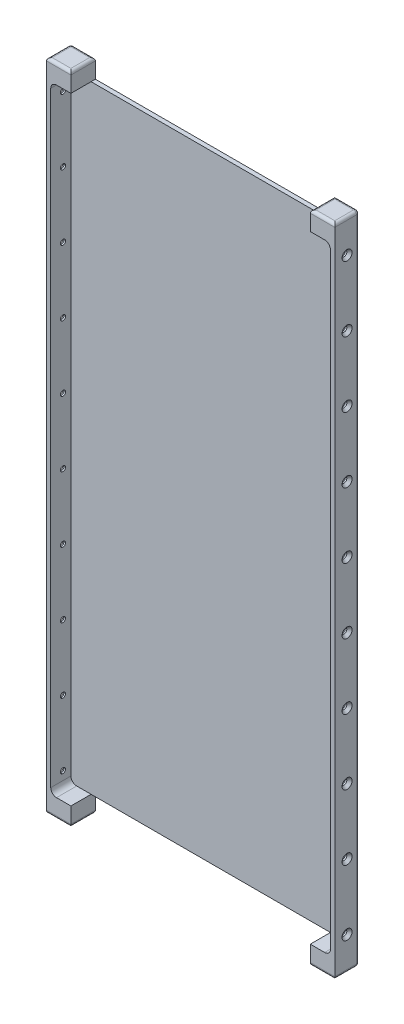
from build123d import *

# Parameters (mm, degrees)
BOSS_EXTRUDE1_DEPTH                           = 8.5
FILLET1_R                                     = 1
SKETCH2_W                                     = 83
SKETCH2_H                                     = 214
CUT_EXTRUDE1_DEPTH                            = 7
SKETCH3_W                                     = 97
SKETCH3_H                                     = 214
CUT_EXTRUDE2_DEPTH                            = 7
FILLET2_R                                     = 2
CSK_FOR_0_FLAT_HEAD_MACHINE_SCREW1_AT_2_COUNT = 2
CSK_FOR_0_FLAT_HEAD_MACHINE_SCREW1_AT_2_PITCH = 22.666666667
CSK_FOR_0_FLAT_HEAD_MACHINE_SCREW1_AT_3_COUNT = 2
CSK_FOR_0_FLAT_HEAD_MACHINE_SCREW1_AT_3_PITCH = 45.333333333
CSK_FOR_0_FLAT_HEAD_MACHINE_SCREW1_AT_4_COUNT = 2
CSK_FOR_0_FLAT_HEAD_MACHINE_SCREW1_AT_4_PITCH = 68
CSK_FOR_0_FLAT_HEAD_MACHINE_SCREW1_AT_5_COUNT = 2
CSK_FOR_0_FLAT_HEAD_MACHINE_SCREW1_AT_5_PITCH = 90.666666667
CSK_FOR_0_FLAT_HEAD_MACHINE_SCREW1_AT_6_COUNT = 2
CSK_FOR_0_FLAT_HEAD_MACHINE_SCREW1_AT_6_PITCH = 113.333333333
CSK_FOR_0_FLAT_HEAD_MACHINE_SCREW1_AT_7_COUNT = 2
CSK_FOR_0_FLAT_HEAD_MACHINE_SCREW1_AT_7_PITCH = 136
CSK_FOR_0_FLAT_HEAD_MACHINE_SCREW1_AT_8_COUNT = 2
CSK_FOR_0_FLAT_HEAD_MACHINE_SCREW1_AT_8_PITCH = 158.666666667
CSK_FOR_0_FLAT_HEAD_MACHINE_SCREW1_AT_9_COUNT = 2
CSK_FOR_0_FLAT_HEAD_MACHINE_SCREW1_AT_9_PITCH = 181.333333333
CSK_FOR_0_FLAT_HEAD_MACHINE_SCREW1_AT_1_COUNT = 2
CSK_FOR_0_FLAT_HEAD_MACHINE_SCREW1_AT_1_PITCH = 204


with BuildPart() as part:
    # Sketch1 → Boss-Extrude1 (new body)
    with BuildSketch(Plane.XY):
        Polygon((-41.5, -107), (41.5, -107), (41.5, -113.5), (50, -113.5), (50, -107), (50, 107), (50, 113.5), (41.5, 113.5), (41.5, 107), (-41.5, 107), (-41.5, 113.5), (-50, 113.5), (-50, 107), (-50, -107), (-50, -113.5), (-41.5, -113.5), align=None)
    extrude(amount=BOSS_EXTRUDE1_DEPTH)

    # Fillet1
    fillet1_edges = [part.edges().sort_by_distance(p)[0] for p in [
        (50, 0, 0),
        (45.75, -113.5, 0),
        (-45.75, -113.5, 0),
        (-50, 0, 0),
        (-45.75, 113.5, 0),
        (-45.75, 113.5, 8.5),
        (45.75, 113.5, 0),
        (50, -113.5, 4.25),
        (41.5, -113.5, 4.25),
        (-41.5, -113.5, 4.25),
        (-50, -113.5, 4.25),
        (-50, 113.5, 4.25),
        (-41.5, 113.5, 4.25),
        (41.5, 113.5, 4.25),
        (50, 113.5, 4.25),
        (-45.75, -113.5, 8.5),
        (45.75, -113.5, 8.5),
        (45.75, 113.5, 8.5),
    ]]
    fillet(fillet1_edges, radius=FILLET1_R)

    # Sketch2 → Cut-Extrude1 (cut)
    with BuildSketch(Plane.XY.offset(8.5)):
        Rectangle(SKETCH2_W, SKETCH2_H)
    extrude(amount=-CUT_EXTRUDE1_DEPTH, mode=Mode.SUBTRACT)

    # Sketch3 → Cut-Extrude2 (cut)
    with BuildSketch(Plane.XY.offset(8.5)):
        Rectangle(SKETCH3_W, SKETCH3_H)
    extrude(amount=-CUT_EXTRUDE2_DEPTH, mode=Mode.SUBTRACT)

    # Fillet2
    fillet2_edges = [part.edges().sort_by_distance(p)[0] for p in [
        (-48.5, 107, 5),
        (48.5, -107, 5),
        (-48.5, -107, 5),
        (48.5, 107, 5),
    ]]
    fillet(fillet2_edges, radius=FILLET2_R)

    # Sketch4 → CSK for #0 Flat Head Machine Screw1 (revolve, cut)
    with BuildSketch(Plane(origin=(-50, 102, 4.25), x_dir=(0, 0, 1), z_dir=(0, 1, 0))):
        Polygon((0, 0), (0, 3.83616509), (0.889, 3.302), (0.889, 0.969878135), (1.7321022, 0), align=None)
    csk_for_0_flat_head_machine_screw1 = revolve(axis=Axis((-56.35, 102, 4.25), (1, 0, 0)), mode=Mode.SUBTRACT)

    # CSK for #0 Flat Head Machine Screw1 at 2: CSK for #0 Flat Head Machine Screw1 ×2
    with Locations(*[(0, -i * CSK_FOR_0_FLAT_HEAD_MACHINE_SCREW1_AT_2_PITCH, 0) for i in range(1, CSK_FOR_0_FLAT_HEAD_MACHINE_SCREW1_AT_2_COUNT)]):
        add(csk_for_0_flat_head_machine_screw1, mode=Mode.SUBTRACT)

    # CSK for #0 Flat Head Machine Screw1 at 3: CSK for #0 Flat Head Machine Screw1 ×2
    with Locations(*[(0, -i * CSK_FOR_0_FLAT_HEAD_MACHINE_SCREW1_AT_3_PITCH, 0) for i in range(1, CSK_FOR_0_FLAT_HEAD_MACHINE_SCREW1_AT_3_COUNT)]):
        add(csk_for_0_flat_head_machine_screw1, mode=Mode.SUBTRACT)

    # CSK for #0 Flat Head Machine Screw1 at 4: CSK for #0 Flat Head Machine Screw1 ×2
    with Locations(*[(0, -i * CSK_FOR_0_FLAT_HEAD_MACHINE_SCREW1_AT_4_PITCH, 0) for i in range(1, CSK_FOR_0_FLAT_HEAD_MACHINE_SCREW1_AT_4_COUNT)]):
        add(csk_for_0_flat_head_machine_screw1, mode=Mode.SUBTRACT)

    # CSK for #0 Flat Head Machine Screw1 at 5: CSK for #0 Flat Head Machine Screw1 ×2
    with Locations(*[(0, -i * CSK_FOR_0_FLAT_HEAD_MACHINE_SCREW1_AT_5_PITCH, 0) for i in range(1, CSK_FOR_0_FLAT_HEAD_MACHINE_SCREW1_AT_5_COUNT)]):
        add(csk_for_0_flat_head_machine_screw1, mode=Mode.SUBTRACT)

    # CSK for #0 Flat Head Machine Screw1 at 6: CSK for #0 Flat Head Machine Screw1 ×2
    with Locations(*[(0, -i * CSK_FOR_0_FLAT_HEAD_MACHINE_SCREW1_AT_6_PITCH, 0) for i in range(1, CSK_FOR_0_FLAT_HEAD_MACHINE_SCREW1_AT_6_COUNT)]):
        add(csk_for_0_flat_head_machine_screw1, mode=Mode.SUBTRACT)

    # CSK for #0 Flat Head Machine Screw1 at 7: CSK for #0 Flat Head Machine Screw1 ×2
    with Locations(*[(0, -i * CSK_FOR_0_FLAT_HEAD_MACHINE_SCREW1_AT_7_PITCH, 0) for i in range(1, CSK_FOR_0_FLAT_HEAD_MACHINE_SCREW1_AT_7_COUNT)]):
        add(csk_for_0_flat_head_machine_screw1, mode=Mode.SUBTRACT)

    # CSK for #0 Flat Head Machine Screw1 at 8: CSK for #0 Flat Head Machine Screw1 ×2
    with Locations(*[(0, -i * CSK_FOR_0_FLAT_HEAD_MACHINE_SCREW1_AT_8_PITCH, 0) for i in range(1, CSK_FOR_0_FLAT_HEAD_MACHINE_SCREW1_AT_8_COUNT)]):
        add(csk_for_0_flat_head_machine_screw1, mode=Mode.SUBTRACT)

    # CSK for #0 Flat Head Machine Screw1 at 9: CSK for #0 Flat Head Machine Screw1 ×2
    with Locations(*[(0, -i * CSK_FOR_0_FLAT_HEAD_MACHINE_SCREW1_AT_9_PITCH, 0) for i in range(1, CSK_FOR_0_FLAT_HEAD_MACHINE_SCREW1_AT_9_COUNT)]):
        add(csk_for_0_flat_head_machine_screw1, mode=Mode.SUBTRACT)

    # CSK for #0 Flat Head Machine Screw1 at 1: CSK for #0 Flat Head Machine Screw1 ×2
    with Locations(*[(0, -i * CSK_FOR_0_FLAT_HEAD_MACHINE_SCREW1_AT_1_PITCH, 0) for i in range(1, CSK_FOR_0_FLAT_HEAD_MACHINE_SCREW1_AT_1_COUNT)]):
        add(csk_for_0_flat_head_machine_screw1, mode=Mode.SUBTRACT)

    # Mirror1: CSK for #0 Flat Head Machine Screw1 across plane
    add(csk_for_0_flat_head_machine_screw1.mirror(Plane(origin=(0, 0, 0), x_dir=(0, 0, 1), z_dir=(1, 0, 0))), mode=Mode.SUBTRACT)

    # Mirror1 copy 1 sketch → Mirror1 copy 1 (revolve, cut)
    with BuildSketch(Plane(origin=(50, 79.333333333, 4.25), x_dir=(0, 0, 1), z_dir=(0, 1, 0))):
        Polygon((0, 0), (0, -3.83616509), (0.889, -3.302), (0.889, -0.969878135), (1.7321022, 0), align=None)
    revolve(axis=Axis((56.35, 79.333333333, 4.25), (1, 0, 0)), mode=Mode.SUBTRACT)

    # Mirror1 copy 2 sketch → Mirror1 copy 2 (revolve, cut)
    with BuildSketch(Plane(origin=(50, 56.666666667, 4.25), x_dir=(0, 0, 1), z_dir=(0, 1, 0))):
        Polygon((0, 0), (0, -3.83616509), (0.889, -3.302), (0.889, -0.969878135), (1.7321022, 0), align=None)
    revolve(axis=Axis((56.35, 56.666666667, 4.25), (1, 0, 0)), mode=Mode.SUBTRACT)

    # Mirror1 copy 3 sketch → Mirror1 copy 3 (revolve, cut)
    with BuildSketch(Plane(origin=(50, 34, 4.25), x_dir=(0, 0, 1), z_dir=(0, 1, 0))):
        Polygon((0, 0), (0, -3.83616509), (0.889, -3.302), (0.889, -0.969878135), (1.7321022, 0), align=None)
    revolve(axis=Axis((56.35, 34, 4.25), (1, 0, 0)), mode=Mode.SUBTRACT)

    # Mirror1 copy 4 sketch → Mirror1 copy 4 (revolve, cut)
    with BuildSketch(Plane(origin=(50, 11.333333333, 4.25), x_dir=(0, 0, 1), z_dir=(0, 1, 0))):
        Polygon((0, 0), (0, -3.83616509), (0.889, -3.302), (0.889, -0.969878135), (1.7321022, 0), align=None)
    revolve(axis=Axis((56.35, 11.333333333, 4.25), (1, 0, 0)), mode=Mode.SUBTRACT)

    # Mirror1 copy 5 sketch → Mirror1 copy 5 (revolve, cut)
    with BuildSketch(Plane(origin=(50, -11.333333333, 4.25), x_dir=(0, 0, 1), z_dir=(0, 1, 0))):
        Polygon((0, 0), (0, -3.83616509), (0.889, -3.302), (0.889, -0.969878135), (1.7321022, 0), align=None)
    revolve(axis=Axis((56.35, -11.333333333, 4.25), (1, 0, 0)), mode=Mode.SUBTRACT)

    # Mirror1 copy 6 sketch → Mirror1 copy 6 (revolve, cut)
    with BuildSketch(Plane(origin=(50, -34, 4.25), x_dir=(0, 0, 1), z_dir=(0, 1, 0))):
        Polygon((0, 0), (0, -3.83616509), (0.889, -3.302), (0.889, -0.969878135), (1.7321022, 0), align=None)
    revolve(axis=Axis((56.35, -34, 4.25), (1, 0, 0)), mode=Mode.SUBTRACT)

    # Mirror1 copy 7 sketch → Mirror1 copy 7 (revolve, cut)
    with BuildSketch(Plane(origin=(50, -56.666666667, 4.25), x_dir=(0, 0, 1), z_dir=(0, 1, 0))):
        Polygon((0, 0), (0, -3.83616509), (0.889, -3.302), (0.889, -0.969878135), (1.7321022, 0), align=None)
    revolve(axis=Axis((56.35, -56.666666667, 4.25), (1, 0, 0)), mode=Mode.SUBTRACT)

    # Mirror1 copy 8 sketch → Mirror1 copy 8 (revolve, cut)
    with BuildSketch(Plane(origin=(50, -79.333333333, 4.25), x_dir=(0, 0, 1), z_dir=(0, 1, 0))):
        Polygon((0, 0), (0, -3.83616509), (0.889, -3.302), (0.889, -0.969878135), (1.7321022, 0), align=None)
    revolve(axis=Axis((56.35, -79.333333333, 4.25), (1, 0, 0)), mode=Mode.SUBTRACT)

    # Mirror1 copy 9 sketch → Mirror1 copy 9 (revolve, cut)
    with BuildSketch(Plane(origin=(50, -102, 4.25), x_dir=(0, 0, 1), z_dir=(0, 1, 0))):
        Polygon((0, 0), (0, -3.83616509), (0.889, -3.302), (0.889, -0.969878135), (1.7321022, 0), align=None)
    revolve(axis=Axis((56.35, -102, 4.25), (1, 0, 0)), mode=Mode.SUBTRACT)


solid = part.part
